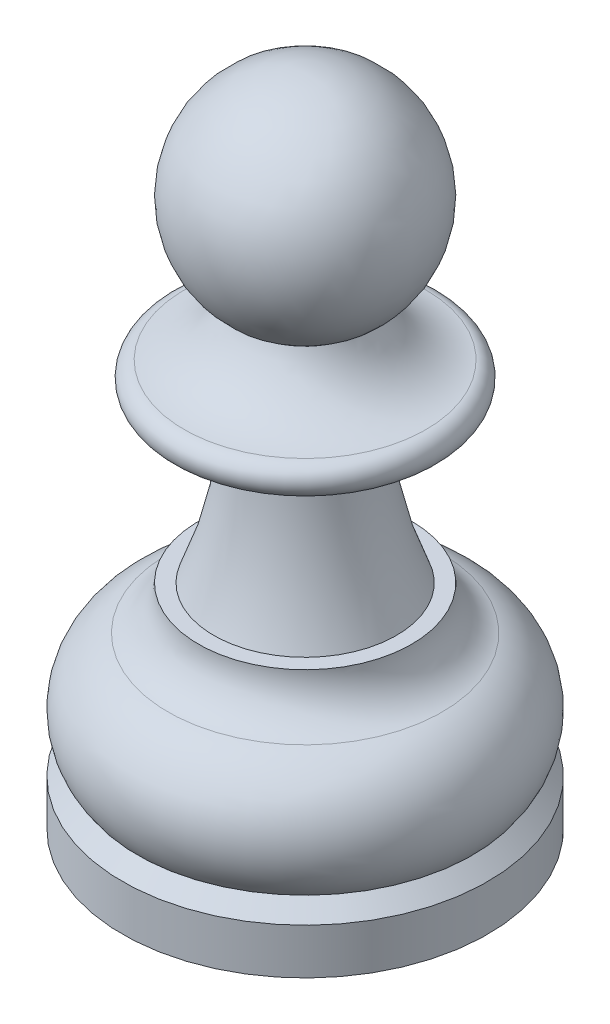
from build123d import *


with BuildPart() as part:
    # Sketch1 → Revolve2 (revolve)
    with BuildSketch(Plane.XY, mode=Mode.PRIVATE) as revolve2_sk:
        with BuildLine():
            Line((0, 0), (0, 43))
            ThreePointArc((0, 43), (6.745368782, 37.870828693), (3.605551275, 30))
            ThreePointArc((3.605551275, 30), (5.320030077, 27.746998352), (7.94372856, 26.683203135))
            ThreePointArc((7.94372856, 26.683203135), (8.825947362, 25.718554332), (8, 24.705307923))
            Line((8, 24.705307923), (4, 24))
            ThreePointArc((4, 24), (4.504902432, 18.900980486), (6, 14))
            Line((6, 14), (7, 14))
            ThreePointArc((7, 14), (7.549619925, 12.255305385), (9, 11.140657908))
            ThreePointArc((9, 11.140657908), (11.830797515, 8.08311014), (11, 4))
            Line((11, 4), (12, 3))
            Line((12, 3), (12, 0))
            Line((12, 0), (0, 0))
        make_face()
    revolve(revolve2_sk.sketch.rotate(Axis((0, 0, 0), (0, 1, 0)), 90), axis=Axis((0, 0, 0), (0, 1, 0)))


solid = part.part
